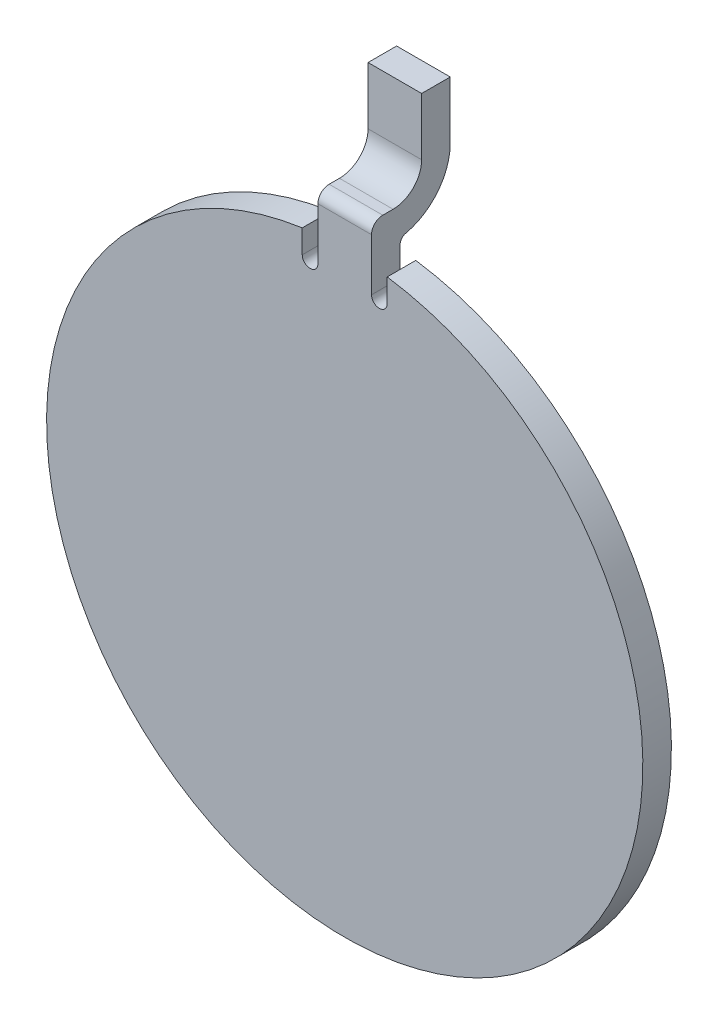
from build123d import *

# Parameters (mm, degrees)
BOSS_EXTRUDE1_DEPTH = 0.508
EXTRUDE_THIN1_DEPTH = 0.953015
FILLET1_R           = 0.127
FILLET3_R           = 0.2
CUT_EXTRUDE1_DEPTH  = 40.600214909


with BuildPart() as part:
    # Sketch2 → Boss-Extrude1 (new body)
    with BuildSketch(Plane(origin=(0, 0, 11.176), x_dir=(-1, 0, 0), z_dir=(0, 0, -1))):
        with BuildLine():
            Line((0.476507589, 37.02763682), (0.476507589, 37.705519621))
            Line((0.476507589, 37.705519621), (-0.476507589, 37.705519621))
            Line((-0.476507589, 37.705519621), (-0.476507589, 37.02763682))
            ThreePointArc((-0.476507589, 37.02763682), (0, 26.45089537), (0.476507589, 37.02763682))
        make_face()
    extrude(amount=BOSS_EXTRUDE1_DEPTH)

    # Sketch3 → Extrude-Thin1 (add)
    with BuildSketch(Plane.ZY.offset(0.476507589)):
        with BuildLine():
            Line((11.176, 37.705519621), (10.792876614, 37.705519621))
            ThreePointArc((10.792876614, 37.705519621), (10.433666369, 37.854309376), (10.284876614, 38.213519621))
            Line((10.284876614, 38.213519621), (10.284876614, 39.233944616))
            Line((10.284876614, 39.233944616), (9.776876614, 39.233944616))
            Line((9.776876614, 39.233944616), (9.776876614, 38.213519621))
            ThreePointArc((9.776876614, 38.213519621), (10.074456124, 37.495099131), (10.792876614, 37.197519621))
            Line((10.792876614, 37.197519621), (11.176, 37.197519621))
            Line((11.176, 37.197519621), (11.176, 37.705519621))
        make_face()
    extrude(amount=-EXTRUDE_THIN1_DEPTH)

    # Fillet1
    fillet1_edges = [part.edges().sort_by_distance(p)[0] for p in [
        (-4.5e-08, 37.205223121, 10.668),
    ]]
    fillet(fillet1_edges, radius=FILLET1_R)

    # Fillet3
    fillet3_edges = [part.edges().sort_by_distance(p)[0] for p in [
        (0, 37.705519621, 11.176),
    ]]
    fillet(fillet3_edges, radius=FILLET3_R)

    # Sketch4 → Cut-Extrude1 (cut, through all)
    with BuildSketch(Plane(origin=(0, 0, 10.668), x_dir=(-1, 0, 0), z_dir=(0, 0, -1))):
        with BuildLine():
            Line((0.755096408, 37.083870595), (0.755096408, 36.580152381))
            ThreePointArc((0.755096408, 36.580152381), (0.615801999, 36.440857972), (0.476507589, 36.580152381))
            Line((0.476507589, 36.580152381), (0.476507589, 37.083870595))
            ThreePointArc((0.476507589, 37.083870595), (0.615801999, 37.223165004), (0.755096408, 37.083870595))
        make_face()
        with BuildLine():
            Line((-0.755096408, 37.083870595), (-0.755096408, 36.580152381))
            ThreePointArc((-0.755096408, 36.580152381), (-0.615801999, 36.440857972), (-0.476507589, 36.580152381))
            Line((-0.476507589, 36.580152381), (-0.476507589, 37.083870595))
            ThreePointArc((-0.476507589, 37.083870595), (-0.615801999, 37.223165004), (-0.755096408, 37.083870595))
        make_face()
    extrude(amount=-CUT_EXTRUDE1_DEPTH, mode=Mode.SUBTRACT)


solid = part.part
